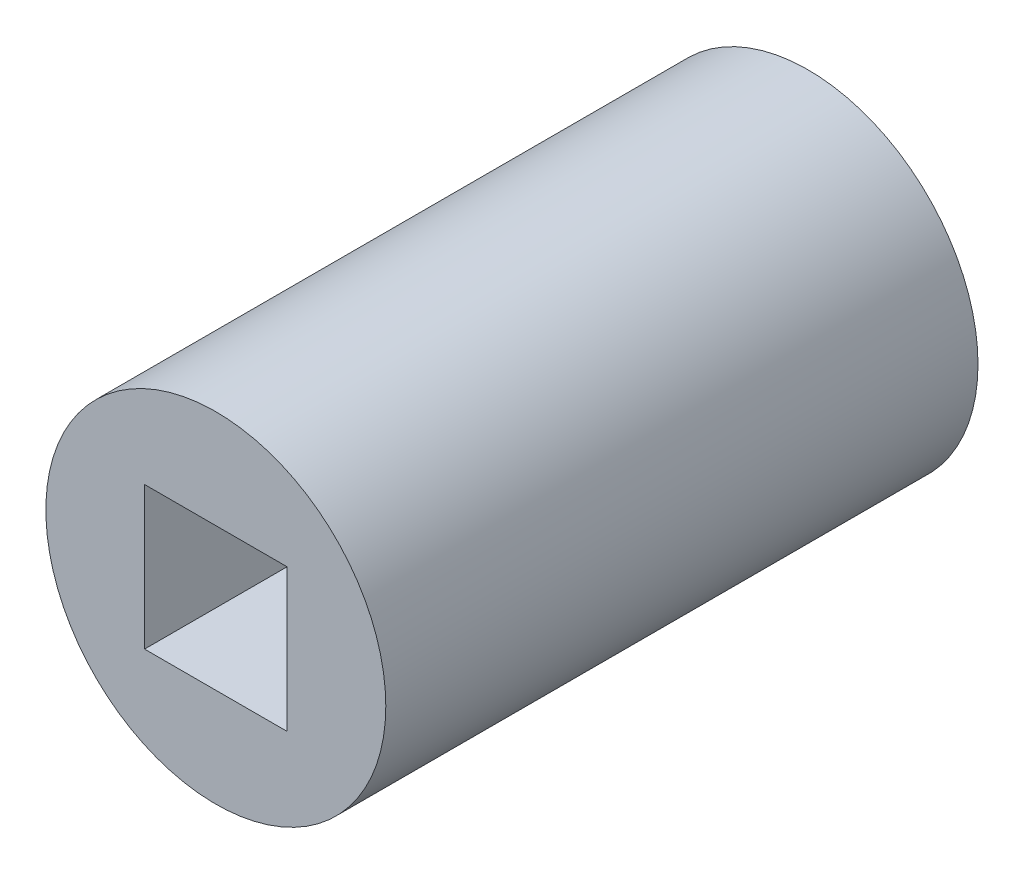
from build123d import *

# Parameters (mm, degrees)
CROQUIS1_R              = 7.75
SALIENTE_EXTRUIR1_DEPTH = 27
CROQUIS2_W              = 6.5
CROQUIS2_H              = 6.5
CORTAR_EXTRUIR1_DEPTH   = 30.139749484
CROQUIS3_R              = 5
SALIENTE_EXTRUIR2_DEPTH = 5
CROQUIS4_R              = 1.75
CORTAR_EXTRUIR2_DEPTH   = 30.139749484
CROQUIS5_R              = 3.25
CORTAR_EXTRUIR3_DEPTH   = 10


with BuildPart() as part:
    # Croquis1 → Saliente-Extruir1 (new body)
    with BuildSketch(Plane.XY):
        Circle(CROQUIS1_R)
    extrude(amount=-SALIENTE_EXTRUIR1_DEPTH)

    # Croquis2 → Cortar-Extruir1 (cut, through all)
    with BuildSketch(Plane.XY):
        Rectangle(CROQUIS2_W, CROQUIS2_H)
    extrude(amount=-CORTAR_EXTRUIR1_DEPTH, mode=Mode.SUBTRACT)

    # Croquis3 → Saliente-Extruir2 (add)
    with BuildSketch(Plane(origin=(0, 0, -27), x_dir=(-1, 0, 0), z_dir=(0, 0, -1))):
        Circle(CROQUIS3_R)
    extrude(amount=-SALIENTE_EXTRUIR2_DEPTH)

    # Croquis4 → Cortar-Extruir2 (cut, through all)
    with BuildSketch(Plane(origin=(0, 0, -27), x_dir=(-1, 0, 0), z_dir=(0, 0, -1))):
        Circle(CROQUIS4_R)
    extrude(amount=-CORTAR_EXTRUIR2_DEPTH, mode=Mode.SUBTRACT)

    # Croquis5 → Cortar-Extruir3 (cut)
    with BuildSketch(Plane(origin=(0, 0, -27), x_dir=(-1, 0, 0), z_dir=(0, 0, -1))):
        Circle(CROQUIS5_R)
    extrude(amount=-CORTAR_EXTRUIR3_DEPTH, mode=Mode.SUBTRACT)


solid = part.part
